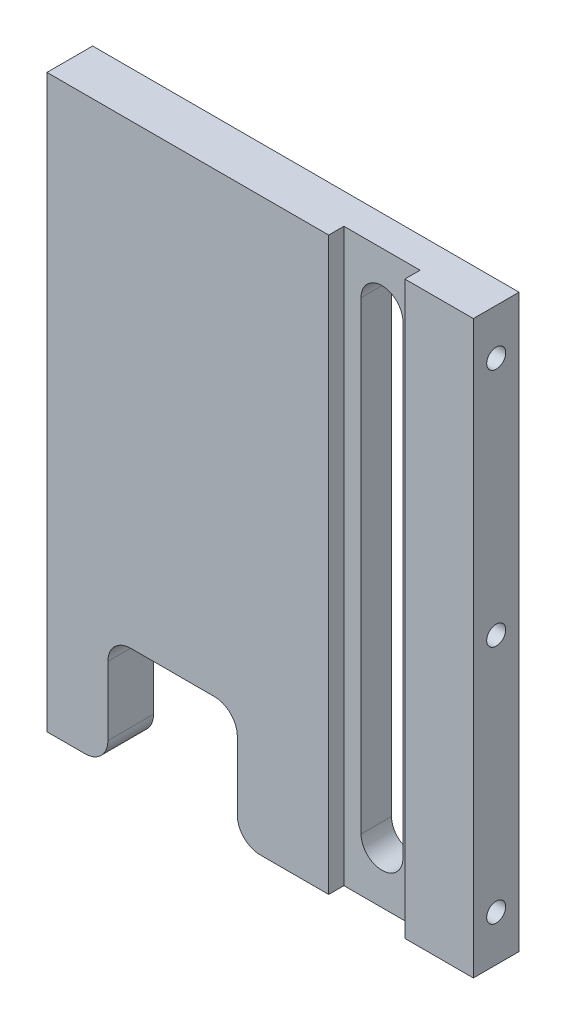
from build123d import *

# Parameters (mm, degrees)
SKETCH_1_W          = 56
SKETCH_1_H          = 75
EXTRUDE_1_DEPTH     = 6
CUT_EXTRUDE_1_DEPTH = 48.183153773
M3X0_51_AT_2_COUNT  = 2
M3X0_51_AT_2_PITCH  = 31.5
M3X0_51_AT_3_COUNT  = 2
M3X0_51_AT_3_PITCH  = 63
SKETCH_6_W          = 10
SKETCH_6_H          = 75
CUT_EXTRUDE_2_DEPTH = 2
SKETCH_7_W          = 17
SKETCH_7_H          = 15
CUT_EXTRUDE_3_DEPTH = 48.183153773
FILLET_1_R          = 3


with BuildPart() as part:
    # Эскиз1 → Бобышка-Вытянуть1 (new body)
    with BuildSketch(Plane.XY):
        Rectangle(SKETCH_1_W, SKETCH_1_H)
    extrude(amount=EXTRUDE_1_DEPTH)

    # Эскиз2 → Вырез-Вытянуть1 (cut, through all)
    with BuildSketch(Plane.XY.offset(6)):
        with BuildLine():
            Line((16.75, 30.5), (16.75, -30.5))
            ThreePointArc((16.75, -30.5), (14, -33.25), (11.25, -30.5))
            Line((11.25, -30.5), (11.25, 30.5))
            ThreePointArc((11.25, 30.5), (14, 33.25), (16.75, 30.5))
        make_face()
    extrude(amount=-CUT_EXTRUDE_1_DEPTH, mode=Mode.SUBTRACT)

    # Эскиз4 → Отверстие обработанное метчиком M3x0.51 (revolve, cut)
    with BuildSketch(Plane(origin=(-28, 31.5, 3), x_dir=(0, 0, 1), z_dir=(0, 1, 0))):
        Polygon((0, 0), (0, 6.751075774), (1.25, 6), (1.25, 0), align=None)
    m3x0_51 = revolve(axis=Axis((-34.35, 31.5, 3), (1, 0, 0)), mode=Mode.SUBTRACT)

    # Отверстие обработанное метчиком M3x0.51 at 2: Отверстие обработанное метчиком M3x0.51 ×2
    with Locations(*[(0, -i * M3X0_51_AT_2_PITCH, 0) for i in range(1, M3X0_51_AT_2_COUNT)]):
        add(m3x0_51, mode=Mode.SUBTRACT)

    # Отверстие обработанное метчиком M3x0.51 at 3: Отверстие обработанное метчиком M3x0.51 ×2
    with Locations(*[(0, -i * M3X0_51_AT_3_PITCH, 0) for i in range(1, M3X0_51_AT_3_COUNT)]):
        add(m3x0_51, mode=Mode.SUBTRACT)

    # Зеркальное отражение1: Отверстие обработанное метчиком M3x0.51 across plane
    add(m3x0_51.mirror(Plane.ZY), mode=Mode.SUBTRACT)

    # Зеркальное отражение1 copy 1 sketch → Зеркальное отражение1 copy 1 (revolve, cut)
    with BuildSketch(Plane(origin=(28, 0, 3), x_dir=(0, 0, 1), z_dir=(0, 1, 0))):
        Polygon((0, 0), (0, -6.751075774), (1.25, -6), (1.25, 0), align=None)
    revolve(axis=Axis((34.35, 0, 3), (1, 0, 0)), mode=Mode.SUBTRACT)

    # Зеркальное отражение1 copy 2 sketch → Зеркальное отражение1 copy 2 (revolve, cut)
    with BuildSketch(Plane(origin=(28, -31.5, 3), x_dir=(0, 0, 1), z_dir=(0, 1, 0))):
        Polygon((0, 0), (0, -6.751075774), (1.25, -6), (1.25, 0), align=None)
    revolve(axis=Axis((34.35, -31.5, 3), (1, 0, 0)), mode=Mode.SUBTRACT)

    # Эскиз6 → Вырез-Вытянуть2 (cut)
    with BuildSketch(Plane.XY.offset(6)):
        with Locations((14, 0)):
            Rectangle(SKETCH_6_W, SKETCH_6_H)
    extrude(amount=-CUT_EXTRUDE_2_DEPTH, mode=Mode.SUBTRACT)

    # Эскиз7 → Вырез-Вытянуть3 (cut, through all)
    with BuildSketch(Plane.XY.offset(6)):
        with Locations((-11.5, -30)):
            Rectangle(SKETCH_7_W, SKETCH_7_H)
    extrude(amount=-CUT_EXTRUDE_3_DEPTH, mode=Mode.SUBTRACT)

    # Скругление1
    fillet_1_edges = [part.edges().sort_by_distance(p)[0] for p in [
        (-3, -22.5, 3),
        (-3, -37.5, 3),
        (-20, -37.5, 3),
        (-20, -22.5, 3),
    ]]
    fillet(fillet_1_edges, radius=FILLET_1_R)


solid = part.part
